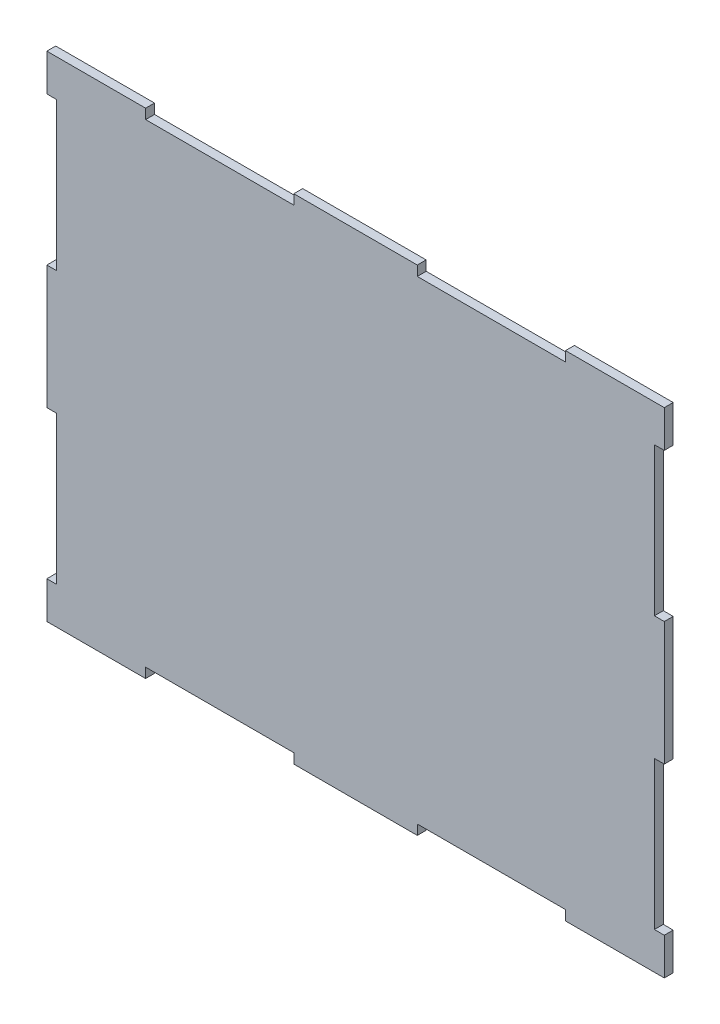
from build123d import *

# Parameters (mm, degrees)
SKETCH_1_W          = 250
SKETCH_1_H          = 200
EXTRUDE_1_DEPTH     = 3.6
SKETCH_2_W          = 4
SKETCH_2_H          = 60
CUT_EXTRUDE_1_DEPTH = 10
SKETCH_3_W          = 60
SKETCH_3_H          = 4
CUT_EXTRUDE_2_DEPTH = 10


with BuildPart() as part:
    # 草图1 → 凸台-拉伸1 (new body)
    with BuildSketch(Plane.XY):
        Rectangle(SKETCH_1_W, SKETCH_1_H)
    extrude(amount=EXTRUDE_1_DEPTH)

    # 草图2 → 切除-拉伸1 (cut)
    with BuildSketch(Plane.XY.offset(3.6)):
        with Locations((-123, 55)):
            Rectangle(SKETCH_2_W, SKETCH_2_H)
        with Locations((123, 55)):
            Rectangle(SKETCH_2_W, SKETCH_2_H)
        with Locations((-123, -55)):
            Rectangle(SKETCH_2_W, SKETCH_2_H)
        with Locations((123, -55)):
            Rectangle(SKETCH_2_W, SKETCH_2_H)
    extrude(amount=-CUT_EXTRUDE_1_DEPTH, mode=Mode.SUBTRACT)

    # 草图3 → 切除-拉伸2 (cut)
    with BuildSketch(Plane.XY.offset(3.6)):
        with Locations((-55, -98)):
            Rectangle(SKETCH_3_W, SKETCH_3_H)
        with Locations((55, -98)):
            Rectangle(SKETCH_3_W, SKETCH_3_H)
        with Locations((55, 98)):
            Rectangle(SKETCH_3_W, SKETCH_3_H)
        with Locations((-55, 98)):
            Rectangle(SKETCH_3_W, SKETCH_3_H)
    extrude(amount=-CUT_EXTRUDE_2_DEPTH, mode=Mode.SUBTRACT)


solid = part.part
